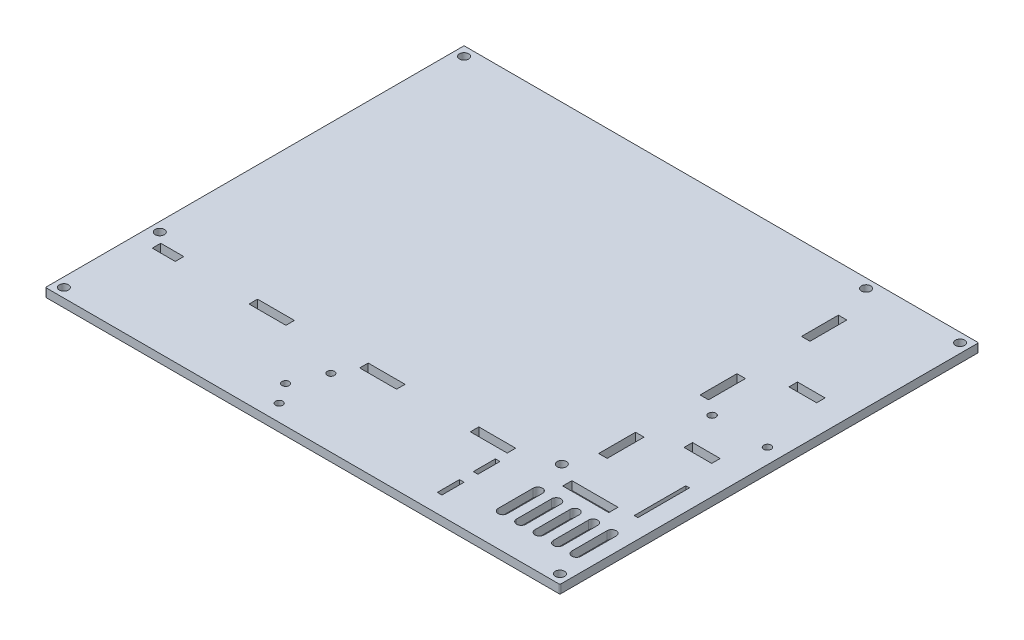
from build123d import *

# Parameters (mm, degrees)
SKETCH1_W           = 281
SKETCH1_H           = 229
SKETCH1_R           = 2.5
SKETCH1_R_2         = 2
SKETCH1_R_3         = 1.95
SKETCH1_W_2         = 12.5
SKETCH1_H_2         = 4.6
SKETCH1_W_3         = 15
SKETCH1_W_4         = 4.6
SKETCH1_H_3         = 20
SKETCH1_W_5         = 20
BOSS_EXTRUDE1_DEPTH = 4.6
SKETCH2_W           = 281
SKETCH2_H           = 229
SKETCH2_W_2         = 279
SKETCH2_H_2         = 227
CUT_EXTRUDE1_DEPTH  = 182.305432903
SKETCH3_W           = 25
SKETCH3_H           = 5
CUT_EXTRUDE2_DEPTH  = 180.899027235
SKETCH6_W           = 2.5
SKETCH6_H           = 12
CUT_EXTRUDE5_DEPTH  = 180.899027235
CUT_EXTRUDE4_DEPTH  = 180.899027235
SKETCH8_W           = 2
SKETCH8_H           = 27.99999988
CUT_EXTRUDE7_DEPTH  = 180.899027235
FILLET2_R           = 0.5


with BuildPart() as part:
    # Sketch1 → Boss-Extrude1 (new body)
    with BuildSketch(Plane(origin=(0, 0, 0), x_dir=(1, 0, 0), z_dir=(0, 1, 0))):
        Rectangle(SKETCH1_W, SKETCH1_H)
        with Locations(Location((-134.5, 108.5, 0), (0, 0, 270))):
            Circle(SKETCH1_R, mode=Mode.SUBTRACT)
        with Locations(Location((134.5, 108.5, 0), (0, 0, 270))):
            Circle(SKETCH1_R, mode=Mode.SUBTRACT)
        with Locations(Location((83.5, 108.5, 0), (0, 0, 270))):
            Circle(SKETCH1_R, mode=Mode.SUBTRACT)
        with Locations(Location((134.5, -108.5, 0), (0, 0, 270))):
            Circle(SKETCH1_R, mode=Mode.SUBTRACT)
        with Locations(Location((83.5, -56.5, 0), (0, 0, 270))):
            Circle(SKETCH1_R, mode=Mode.SUBTRACT)
        with Locations(Location((-134.5, -56.5, 0), (0, 0, 270))):
            Circle(SKETCH1_R, mode=Mode.SUBTRACT)
        with Locations(Location((101.3, 7.23, 0), (0, 0, 270))):
            Circle(SKETCH1_R_2, mode=Mode.SUBTRACT)
        with Locations(Location((-134.5, -108.5, 0), (0, 0, 270))):
            Circle(SKETCH1_R, mode=Mode.SUBTRACT)
        with Locations(Location((131.3, 7.23, 0), (0, 0, 270))):
            Circle(SKETCH1_R_2, mode=Mode.SUBTRACT)
        with Locations(Location((-21.75, -104.5, 0), (0, 0, 270))):
            Circle(SKETCH1_R_3, mode=Mode.SUBTRACT)
        with Locations(Location((-29.25, -93.5, 0), (0, 0, 270))):
            Circle(SKETCH1_R_3, mode=Mode.SUBTRACT)
        with Locations(Location((-21.75, -76.5, 0), (0, 0, 270))):
            Circle(SKETCH1_R_3, mode=Mode.SUBTRACT)
        with Locations((-122.75, -63.8)):
            Rectangle(SKETCH1_W_2, SKETCH1_H_2, mode=Mode.SUBTRACT)
        with Locations((116.3, 43.7)):
            Rectangle(SKETCH1_W_3, SKETCH1_H_2, mode=Mode.SUBTRACT)
        with Locations((116.3, -13.2)):
            Rectangle(SKETCH1_W_3, SKETCH1_H_2, mode=Mode.SUBTRACT)
        with Locations((90.8, -31.5)):
            Rectangle(SKETCH1_W_4, SKETCH1_H_3, mode=Mode.SUBTRACT)
        with Locations((90.8, 78.5)):
            Rectangle(SKETCH1_W_4, SKETCH1_H_3, mode=Mode.SUBTRACT)
        with Locations((-66.5, -63.8)):
            Rectangle(SKETCH1_W_5, SKETCH1_H_2, mode=Mode.SUBTRACT)
        with Locations((53.5, -63.8)):
            Rectangle(SKETCH1_W_5, SKETCH1_H_2, mode=Mode.SUBTRACT)
        with Locations((90.8, 23.5)):
            Rectangle(SKETCH1_W_4, SKETCH1_H_3, mode=Mode.SUBTRACT)
        with Locations((-6.5, -63.8)):
            Rectangle(SKETCH1_W_5, SKETCH1_H_2, mode=Mode.SUBTRACT)
    extrude(amount=BOSS_EXTRUDE1_DEPTH)

    # Sketch2 → Cut-Extrude1 (cut, through all)
    with BuildSketch(Plane(origin=(0, 4.6, 0), x_dir=(1, 0, 0), z_dir=(0, 1, 0))):
        Rectangle(SKETCH2_W, SKETCH2_H)
        Rectangle(SKETCH2_W_2, SKETCH2_H_2, mode=Mode.SUBTRACT)
    extrude(amount=-CUT_EXTRUDE1_DEPTH, mode=Mode.SUBTRACT)

    # Sketch3 → Cut-Extrude2 (cut, through all)
    with BuildSketch(Plane.XZ):
        with Locations((106.5, 64)):
            Rectangle(SKETCH3_W, SKETCH3_H)
    extrude(amount=-CUT_EXTRUDE2_DEPTH, mode=Mode.SUBTRACT)

    # Sketch6 → Cut-Extrude5 (cut, through all)
    with BuildSketch(Plane(origin=(0, 4.6, 0), x_dir=(1, 0, 0), z_dir=(0, 1, 0))):
        with Locations((64.25, -78)):
            Rectangle(SKETCH6_W, SKETCH6_H)
        with Locations((64.25, -97.5)):
            Rectangle(SKETCH6_W, SKETCH6_H)
    extrude(amount=-CUT_EXTRUDE5_DEPTH, mode=Mode.SUBTRACT)

    # Sketch5 → Cut-Extrude4 (cut, through all)
    with BuildSketch(Plane(origin=(0, 0, 0), x_dir=(1, 0, 0), z_dir=(0, 1, 0))):
        with BuildLine():
            Line((132, -75.5), (132, -94.5))
            ThreePointArc((132, -94.5), (129.5, -97), (127, -94.5))
            Line((127, -94.5), (127, -75.5))
            ThreePointArc((127, -75.5), (129.5, -73), (132, -75.5))
        make_face()
        with BuildLine():
            Line((122, -75.5), (122, -94.5))
            ThreePointArc((122, -94.5), (119.5, -97), (117, -94.5))
            Line((117, -94.5), (117, -75.5))
            ThreePointArc((117, -75.5), (119.5, -73), (122, -75.5))
        make_face()
        with BuildLine():
            Line((112, -75.5), (112, -94.5))
            ThreePointArc((112, -94.5), (109.5, -97), (107, -94.5))
            Line((107, -94.5), (107, -75.5))
            ThreePointArc((107, -75.5), (109.5, -73), (112, -75.5))
        make_face()
        with BuildLine():
            Line((102, -75.5), (102, -94.5))
            ThreePointArc((102, -94.5), (99.5, -97), (97, -94.5))
            Line((97, -94.5), (97, -75.5))
            ThreePointArc((97, -75.5), (99.5, -73), (102, -75.5))
        make_face()
        with BuildLine():
            Line((92, -75.5), (92, -94.5))
            ThreePointArc((92, -94.5), (89.5, -97), (87, -94.5))
            Line((87, -94.5), (87, -75.5))
            ThreePointArc((87, -75.5), (89.5, -73), (92, -75.5))
        make_face()
    extrude(amount=CUT_EXTRUDE4_DEPTH, mode=Mode.SUBTRACT)

    # Sketch8 → Cut-Extrude7 (cut, through all)
    with BuildSketch(Plane(origin=(0, 4.6, 0), x_dir=(1, 0, 0), z_dir=(0, 1, 0))):
        with Locations((128.26444081, -47.0000889)):
            Rectangle(SKETCH8_W, SKETCH8_H)
    extrude(amount=-CUT_EXTRUDE7_DEPTH, mode=Mode.SUBTRACT)

    # Fillet2
    fillet2_edges = [part.edges().sort_by_distance(p)[0] for p in [
        (-139.5, 2.3, -113.5),
        (139.5, 2.3, -113.5),
        (139.5, 2.3, 113.5),
        (-139.5, 2.3, 113.5),
    ]]
    fillet(fillet2_edges, radius=FILLET2_R)


solid = part.part
